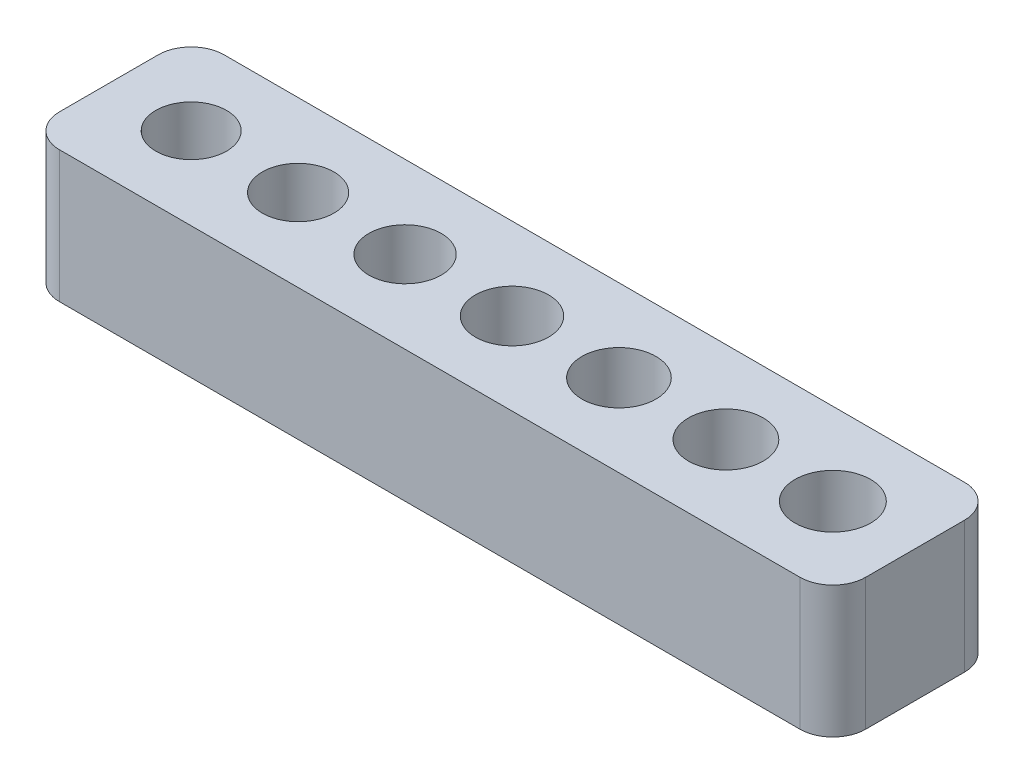
from build123d import *

# Parameters (mm, degrees)
SKETCH1_W           = 49
SKETCH1_H           = 10
SKETCH1_R           = 2.15
SKETCH1_R_2         = 2.175
SKETCH1_R_3         = 2.2
SKETCH1_R_4         = 2.225
SKETCH1_R_5         = 2.3
SKETCH1_R_6         = 2.25
SKETCH1_R_7         = 2.275
BOSS_EXTRUDE1_DEPTH = 8
FILLET1_R           = 2


with BuildPart() as part:
    # Sketch1 → Boss-Extrude1 (new body)
    with BuildSketch(Plane(origin=(0, 0, 0), x_dir=(1, 0, 0), z_dir=(0, 1, 0))):
        with Locations((24.5, 5)):
            Rectangle(SKETCH1_W, SKETCH1_H)
        with Locations(Location((5, 5, 0), (0, 0, 270))):
            Circle(SKETCH1_R, mode=Mode.SUBTRACT)
        with Locations(Location((11.5, 5, 0), (0, 0, 270))):
            Circle(SKETCH1_R_2, mode=Mode.SUBTRACT)
        with Locations(Location((18, 5, 0), (0, 0, 270))):
            Circle(SKETCH1_R_3, mode=Mode.SUBTRACT)
        with Locations(Location((24.5, 5, 0), (0, 0, 270))):
            Circle(SKETCH1_R_4, mode=Mode.SUBTRACT)
        with Locations(Location((44, 5, 0), (0, 0, 270))):
            Circle(SKETCH1_R_5, mode=Mode.SUBTRACT)
        with Locations(Location((31, 5, 0), (0, 0, 270))):
            Circle(SKETCH1_R_6, mode=Mode.SUBTRACT)
        with Locations(Location((37.5, 5, 0), (0, 0, 270))):
            Circle(SKETCH1_R_7, mode=Mode.SUBTRACT)
    extrude(amount=BOSS_EXTRUDE1_DEPTH)

    # Fillet1
    fillet1_edges = [part.edges().sort_by_distance(p)[0] for p in [
        (0, 4, -10),
        (49, 4, -10),
        (49, 4, 0),
        (0, 4, 0),
    ]]
    fillet(fillet1_edges, radius=FILLET1_R)


solid = part.part
